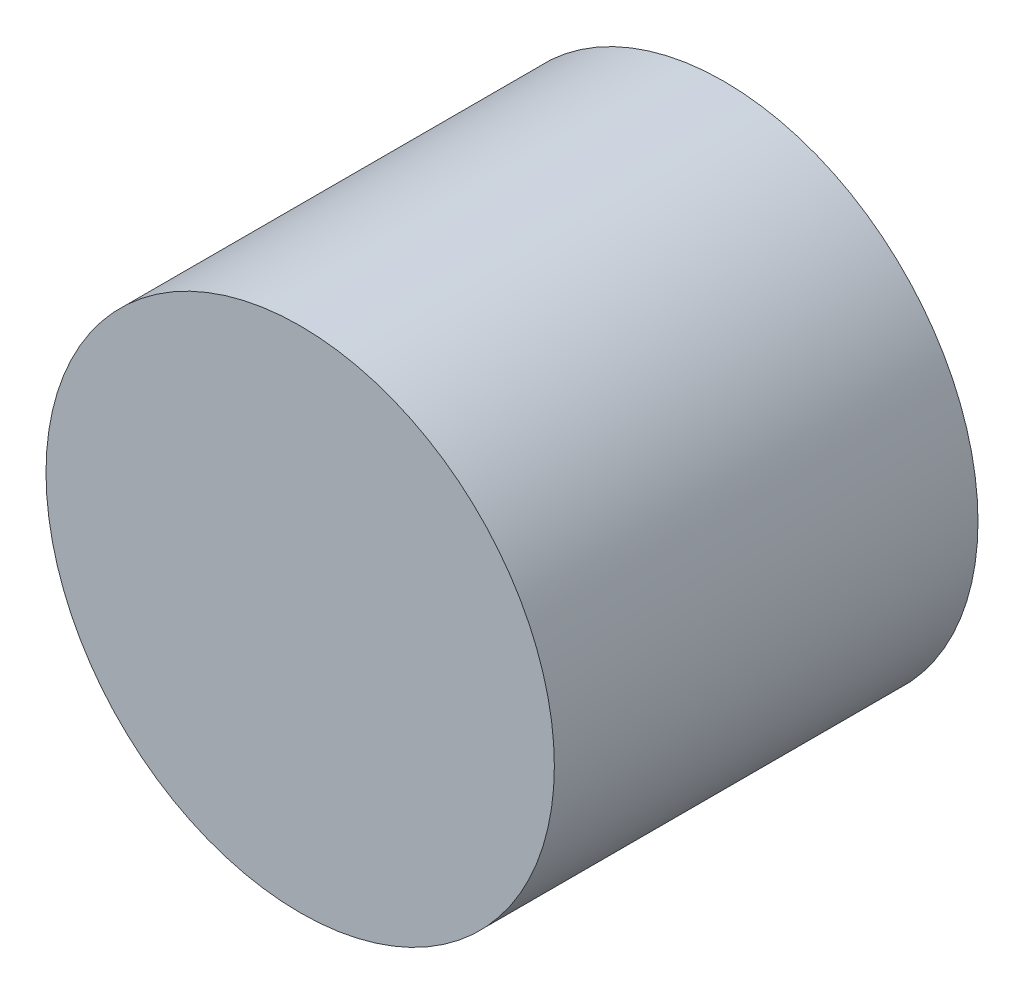
from build123d import *

# Parameters (mm, degrees)
BOSS_EXTRU_1_DEPTH = 5
ESQUISSE2_R        = 1.5
BOSS_EXTRU_2_DEPTH = 2
ESQUISSE3_R        = 15
BOSS_EXTRU_3_DEPTH = 25


with BuildPart() as part:
    # Esquisse1 → Boss.-Extru.1 (new body)
    with BuildSketch(Plane.XY):
        with BuildLine():
            ThreePointArc((-1.118033989, 1), (-1.369306394, -0.612372436), (0, -1.5))
            Line((0, -1.5), (0, 1))
            Line((0, 1), (-1.118033989, 1))
        make_face()
        with BuildLine():
            Line((0, 1), (0, -1.5))
            ThreePointArc((0, -1.5), (1.060660172, -1.060660172), (1.5, 0))
            ThreePointArc((1.5, 0), (1.401258538, 0.535233135), (1.118033989, 1))
            Line((1.118033989, 1), (0, 1))
        make_face()
    extrude(amount=BOSS_EXTRU_1_DEPTH)

    # Esquisse2 → Boss.-Extru.2 (add)
    with BuildSketch(Plane.XY.offset(5)):
        with Locations(Location((0, 0, 0), (0, 0, 138.189685104))):
            Circle(ESQUISSE2_R)
    extrude(amount=BOSS_EXTRU_2_DEPTH)

    # Esquisse3 → Boss.-Extru.3 (add)
    with BuildSketch(Plane.XY.offset(7)):
        with Locations((0, 0.131238961)):
            Circle(ESQUISSE3_R)
    extrude(amount=BOSS_EXTRU_3_DEPTH)


solid = part.part
